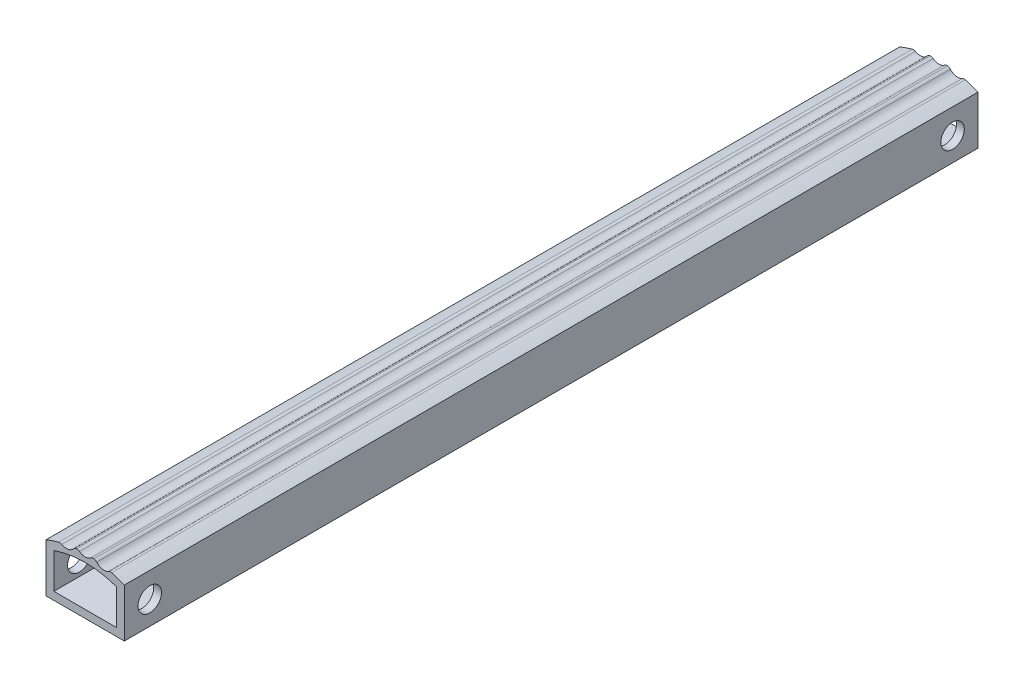
from build123d import *

# Parameters (mm, degrees)
BOSS_EXTRU_1_DEPTH      = 54.5
ESQUISSE2_R             = 1.5
ENL_V_MAT_EXTRU_1_DEPTH = 56.87007968


with BuildPart() as part:
    # Esquisse1 → Boss.-Extru.1 (new, symmetric)
    with BuildSketch(Plane.XY):
        with BuildLine():
            Line((-5, 0), (5, 0))
            Line((5, 0), (5, 6.2))
            ThreePointArc((5, 6.2), (4.198380709, 6.503397881), (3.378511037, 6.753312837))
            ThreePointArc((3.378511037, 6.753312837), (3.182940128, 6.766167342), (2.997453176, 6.702860077))
            ThreePointArc((2.997453176, 6.702860077), (2.185788495, 6.558879309), (1.472744558, 6.972519685))
            ThreePointArc((1.472744558, 6.972519685), (1.320223309, 7.095607002), (1.132107007, 7.150611326))
            ThreePointArc((1.132107007, 7.150611326), (1.107721314, 7.152719926), (1.083331695, 7.154782609))
            ThreePointArc((1.083331695, 7.154782609), (0.899623928, 7.135921685), (0.735293006, 7.051662404))
            ThreePointArc((0.735293006, 7.051662404), (0, 6.8), (-0.735293006, 7.051662404))
            ThreePointArc((-0.735293006, 7.051662404), (-0.899623928, 7.135921685), (-1.083331695, 7.154782609))
            ThreePointArc((-1.083331695, 7.154782609), (-1.107721314, 7.152719926), (-1.132107007, 7.150611326))
            ThreePointArc((-1.132107007, 7.150611326), (-1.320223309, 7.095607002), (-1.472744558, 6.972519685))
            ThreePointArc((-1.472744558, 6.972519685), (-2.185788495, 6.558879309), (-2.997453176, 6.702860077))
            ThreePointArc((-2.997453176, 6.702860077), (-3.182940128, 6.766167342), (-3.378511037, 6.753312837))
            ThreePointArc((-3.378511037, 6.753312837), (-4.198380709, 6.503397881), (-5, 6.2))
            Line((-5, 6.2), (-5, 0))
        make_face()
        with BuildLine():
            Line((-4, 1), (-4, 5.513708499))
            ThreePointArc((-4, 5.513708499), (0, 6.2), (4, 5.513708499))
            Line((4, 5.513708499), (4, 1))
            Line((4, 1), (-4, 1))
        make_face(mode=Mode.SUBTRACT)
    extrude(amount=BOSS_EXTRU_1_DEPTH, both=True)

    # Esquisse2 → Enlèv. mat.-Extru.1 (cut, through all)
    with BuildSketch(Plane.ZY.offset(5)):
        with Locations((-51.25, 3)):
            Circle(ESQUISSE2_R)
        with Locations((51.25, 3)):
            Circle(ESQUISSE2_R)
    extrude(amount=-ENL_V_MAT_EXTRU_1_DEPTH, mode=Mode.SUBTRACT)


solid = part.part
